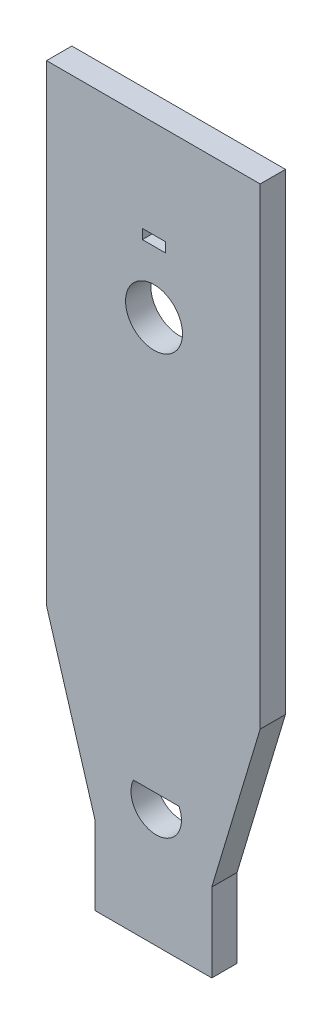
from build123d import *

# Parameters (mm, degrees)
SKETCH1_R           = 3.375
BOSS_EXTRUDE3_DEPTH = 3
SKETCH5_W           = 2.76
SKETCH5_H           = 1.15
CUT_EXTRUDE3_DEPTH  = 448.473185448


with BuildPart() as part:
    # Sketch1 → Boss-Extrude3 (new body)
    with BuildSketch(Plane.XY):
        Polygon((-364.123724325, 176.492478394), (-369.858869661, 195.576225703), (-369.858869661, 251.55599422), (-344.532032114, 251.55599422), (-344.532032114, 195.576225703), (-350.26717745, 176.492478394), (-350.26717745, 167.153932289), (-364.123724325, 167.153932289), align=None)
        with Locations((-357.117541936, 231.55599422)):
            Circle(SKETCH1_R, mode=Mode.SUBTRACT)
    extrude(amount=BOSS_EXTRUDE3_DEPTH)

    # Sketch5 → Cut-Extrude3 (cut, through all)
    with BuildSketch(Plane.XY.offset(-9.5)):
        with BuildLine():
            Line((-359.5563, 182.840556402), (-354.1563, 182.840556402))
            ThreePointArc((-354.1563, 182.840556402), (-356.8563, 178.555993811), (-359.5563, 182.840556402))
        make_face()
        with Locations((-357.117541936, 239.434089807)):
            Rectangle(SKETCH5_W, SKETCH5_H)
    extrude(amount=CUT_EXTRUDE3_DEPTH, mode=Mode.SUBTRACT)


solid = part.part
